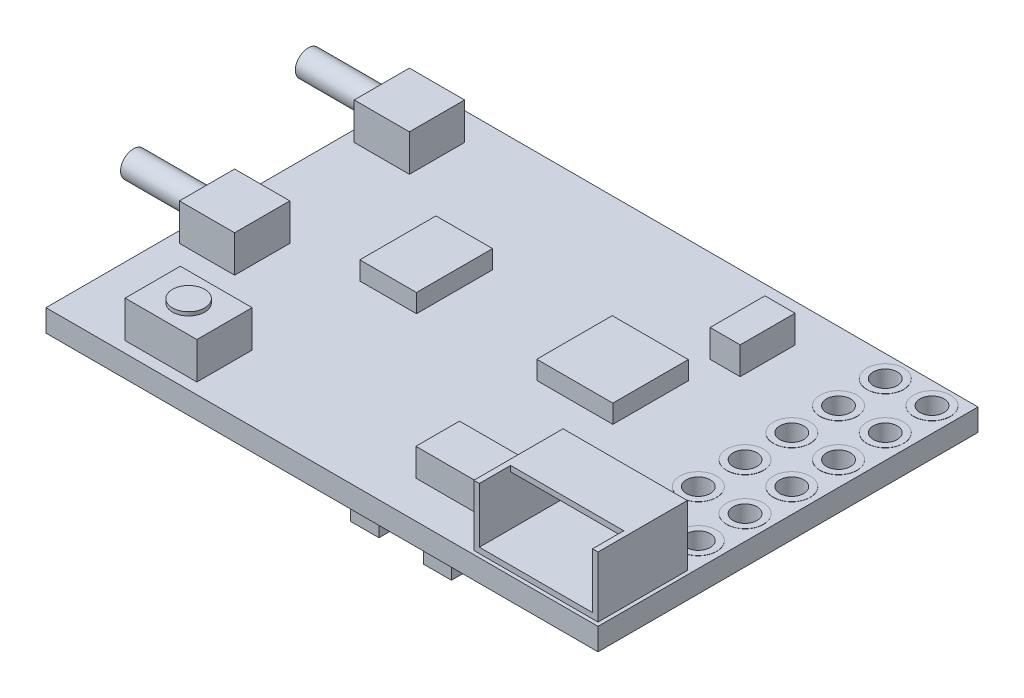
from build123d import *

# Parameters (mm, degrees)
SKETCH1_W            = 30
SKETCH1_H            = 20.65
BOSS_EXTRUDE1_DEPTH  = 1.2
CUT_EXTRUDE1_REACH   = 20.25
SKETCH2_R            = 0.65
SKETCH3_W            = 6.75
SKETCH3_H            = 4.85
BOSS_EXTRUDE2_DEPTH  = 3.3
SKETCH4_W            = 3
SKETCH4_H            = 3
BOSS_EXTRUDE3_DEPTH  = 2
SKETCH5_W            = 3.9
SKETCH5_H            = 3
BOSS_EXTRUDE4_DEPTH  = 2
SKETCH6_R            = 0.875
BOSS_EXTRUDE5_DEPTH  = 0.2
SKETCH7_W            = 6.15
SKETCH7_H            = 1.7
CUT_EXTRUDE2_DEPTH   = 3
SKETCH8_W            = 6.15
SKETCH8_H            = 2.7
CUT_EXTRUDE3_DEPTH   = 2.85
SKETCH9_W            = 4.13358082
SKETCH9_H            = 4.101537558
SKETCH9_W_2          = 3.076153169
SKETCH9_H_2          = 4.13358082
BOSS_EXTRUDE6_DEPTH  = 1
SKETCH10_W           = 1.634206371
SKETCH10_H           = 2.980023382
SKETCH10_W_2         = 4.454013442
SKETCH10_H_2         = 2.371201401
BOSS_EXTRUDE7_DEPTH  = 1.5
SKETCH11_W           = 6.849678862
SKETCH11_H           = 6.849678863
SKETCH11_W_2         = 1.518707079
SKETCH11_H_2         = 3.006420134
SKETCH11_W_3         = 1.5497011
SKETCH11_H_3         = 3.068408178
SKETCH11_W_4         = 1.177772837
SKETCH11_H_4         = 2.758467958
SKETCH11_W_5         = 2.86022906
SKETCH11_H_5         = 4.18419297
SKETCH11_W_6         = 2.386539694
SKETCH11_H_6         = 3.0994022
SKETCH11_W_7         = 1.270754903
SKETCH11_H_7         = 3.161390244
BOSS_EXTRUDE8_DEPTH  = 1.5
BOSS_EXTRUDE9_START  = 0.01
SKETCH12_R           = 1
SKETCH12_R_2         = 0.65
BOSS_EXTRUDE9_DEPTH  = 0.01
SKETCH13_R           = 0.7
BOSS_EXTRUDE10_DEPTH = 4


with BuildPart() as part:
    # Sketch1 → Boss-Extrude1 (new body)
    with BuildSketch(Plane(origin=(0, 0, 0), x_dir=(1, 0, 0), z_dir=(0, 1, 0))):
        Rectangle(SKETCH1_W, SKETCH1_H)
    extrude(amount=BOSS_EXTRUDE1_DEPTH)

    # Sketch2 → Cut-Extrude1 (cut, up to next)
    with BuildSketch(Plane(origin=(0, 1.2, 0), x_dir=(1, 0, 0), z_dir=(0, 1, 0)), mode=Mode.PRIVATE) as cut_extrude1_sk1:
        with Locations(Location((13.7, 9.125, 0), (0, 0, 270))):
            Circle(SKETCH2_R)
    cut_extrude1_tool1 = extrude(cut_extrude1_sk1.sketch, amount=-CUT_EXTRUDE1_REACH, mode=Mode.PRIVATE) & part.part
    # Sketch2 → Cut-Extrude1 (cut, up to next)
    with BuildSketch(Plane(origin=(0, 1.2, 0), x_dir=(1, 0, 0), z_dir=(0, 1, 0)), mode=Mode.PRIVATE) as cut_extrude1_sk2:
        with Locations(Location((11.16, 9.125, 0), (0, 0, 270))):
            Circle(SKETCH2_R)
    cut_extrude1_tool2 = extrude(cut_extrude1_sk2.sketch, amount=-CUT_EXTRUDE1_REACH, mode=Mode.PRIVATE) & part.part
    # Sketch2 → Cut-Extrude1 (cut, up to next)
    with BuildSketch(Plane(origin=(0, 1.2, 0), x_dir=(1, 0, 0), z_dir=(0, 1, 0)), mode=Mode.PRIVATE) as cut_extrude1_sk3:
        with Locations(Location((11.16, 6.585, 0), (0, 0, 270))):
            Circle(SKETCH2_R)
    cut_extrude1_tool3 = extrude(cut_extrude1_sk3.sketch, amount=-CUT_EXTRUDE1_REACH, mode=Mode.PRIVATE) & part.part
    # Sketch2 → Cut-Extrude1 (cut, up to next)
    with BuildSketch(Plane(origin=(0, 1.2, 0), x_dir=(1, 0, 0), z_dir=(0, 1, 0)), mode=Mode.PRIVATE) as cut_extrude1_sk4:
        with Locations(Location((11.16, 4.045, 0), (0, 0, 270))):
            Circle(SKETCH2_R)
    cut_extrude1_tool4 = extrude(cut_extrude1_sk4.sketch, amount=-CUT_EXTRUDE1_REACH, mode=Mode.PRIVATE) & part.part
    # Sketch2 → Cut-Extrude1 (cut, up to next)
    with BuildSketch(Plane(origin=(0, 1.2, 0), x_dir=(1, 0, 0), z_dir=(0, 1, 0)), mode=Mode.PRIVATE) as cut_extrude1_sk5:
        with Locations(Location((11.16, 1.505, 0), (0, 0, 270))):
            Circle(SKETCH2_R)
    cut_extrude1_tool5 = extrude(cut_extrude1_sk5.sketch, amount=-CUT_EXTRUDE1_REACH, mode=Mode.PRIVATE) & part.part
    # Sketch2 → Cut-Extrude1 (cut, up to next)
    with BuildSketch(Plane(origin=(0, 1.2, 0), x_dir=(1, 0, 0), z_dir=(0, 1, 0)), mode=Mode.PRIVATE) as cut_extrude1_sk6:
        with Locations(Location((11.16, -1.035, 0), (0, 0, 270))):
            Circle(SKETCH2_R)
    cut_extrude1_tool6 = extrude(cut_extrude1_sk6.sketch, amount=-CUT_EXTRUDE1_REACH, mode=Mode.PRIVATE) & part.part
    # Sketch2 → Cut-Extrude1 (cut, up to next)
    with BuildSketch(Plane(origin=(0, 1.2, 0), x_dir=(1, 0, 0), z_dir=(0, 1, 0)), mode=Mode.PRIVATE) as cut_extrude1_sk7:
        with Locations(Location((11.16, -3.575, 0), (0, 0, 270))):
            Circle(SKETCH2_R)
    cut_extrude1_tool7 = extrude(cut_extrude1_sk7.sketch, amount=-CUT_EXTRUDE1_REACH, mode=Mode.PRIVATE) & part.part
    # Sketch2 → Cut-Extrude1 (cut, up to next)
    with BuildSketch(Plane(origin=(0, 1.2, 0), x_dir=(1, 0, 0), z_dir=(0, 1, 0)), mode=Mode.PRIVATE) as cut_extrude1_sk8:
        with Locations(Location((13.7, 6.585, 0), (0, 0, 270))):
            Circle(SKETCH2_R)
    cut_extrude1_tool8 = extrude(cut_extrude1_sk8.sketch, amount=-CUT_EXTRUDE1_REACH, mode=Mode.PRIVATE) & part.part
    # Sketch2 → Cut-Extrude1 (cut, up to next)
    with BuildSketch(Plane(origin=(0, 1.2, 0), x_dir=(1, 0, 0), z_dir=(0, 1, 0)), mode=Mode.PRIVATE) as cut_extrude1_sk9:
        with Locations(Location((13.7, 4.045, 0), (0, 0, 270))):
            Circle(SKETCH2_R)
    cut_extrude1_tool9 = extrude(cut_extrude1_sk9.sketch, amount=-CUT_EXTRUDE1_REACH, mode=Mode.PRIVATE) & part.part
    # Sketch2 → Cut-Extrude1 (cut, up to next)
    with BuildSketch(Plane(origin=(0, 1.2, 0), x_dir=(1, 0, 0), z_dir=(0, 1, 0)), mode=Mode.PRIVATE) as cut_extrude1_sk10:
        with Locations(Location((13.7, 1.505, 0), (0, 0, 270))):
            Circle(SKETCH2_R)
    cut_extrude1_tool10 = extrude(cut_extrude1_sk10.sketch, amount=-CUT_EXTRUDE1_REACH, mode=Mode.PRIVATE) & part.part
    # Sketch2 → Cut-Extrude1 (cut, up to next)
    with BuildSketch(Plane(origin=(0, 1.2, 0), x_dir=(1, 0, 0), z_dir=(0, 1, 0)), mode=Mode.PRIVATE) as cut_extrude1_sk11:
        with Locations(Location((13.7, -1.035, 0), (0, 0, 270))):
            Circle(SKETCH2_R)
    cut_extrude1_tool11 = extrude(cut_extrude1_sk11.sketch, amount=-CUT_EXTRUDE1_REACH, mode=Mode.PRIVATE) & part.part
    # Sketch2 → Cut-Extrude1 (cut, up to next)
    with BuildSketch(Plane(origin=(0, 1.2, 0), x_dir=(1, 0, 0), z_dir=(0, 1, 0)), mode=Mode.PRIVATE) as cut_extrude1_sk12:
        with Locations(Location((13.7, -3.575, 0), (0, 0, 270))):
            Circle(SKETCH2_R)
    cut_extrude1_tool12 = extrude(cut_extrude1_sk12.sketch, amount=-CUT_EXTRUDE1_REACH, mode=Mode.PRIVATE) & part.part
    add(cut_extrude1_tool1.solids().sort_by_distance((13.7, 1.2, -9.125))[0], mode=Mode.SUBTRACT)
    add(cut_extrude1_tool2.solids().sort_by_distance((11.16, 1.2, -9.125))[0], mode=Mode.SUBTRACT)
    add(cut_extrude1_tool3.solids().sort_by_distance((11.16, 1.2, -6.585))[0], mode=Mode.SUBTRACT)
    add(cut_extrude1_tool4.solids().sort_by_distance((11.16, 1.2, -4.045))[0], mode=Mode.SUBTRACT)
    add(cut_extrude1_tool5.solids().sort_by_distance((11.16, 1.2, -1.505))[0], mode=Mode.SUBTRACT)
    add(cut_extrude1_tool6.solids().sort_by_distance((11.16, 1.2, 1.035))[0], mode=Mode.SUBTRACT)
    add(cut_extrude1_tool7.solids().sort_by_distance((11.16, 1.2, 3.575))[0], mode=Mode.SUBTRACT)
    add(cut_extrude1_tool8.solids().sort_by_distance((13.7, 1.2, -6.585))[0], mode=Mode.SUBTRACT)
    add(cut_extrude1_tool9.solids().sort_by_distance((13.7, 1.2, -4.045))[0], mode=Mode.SUBTRACT)
    add(cut_extrude1_tool10.solids().sort_by_distance((13.7, 1.2, -1.505))[0], mode=Mode.SUBTRACT)
    add(cut_extrude1_tool11.solids().sort_by_distance((13.7, 1.2, 1.035))[0], mode=Mode.SUBTRACT)
    add(cut_extrude1_tool12.solids().sort_by_distance((13.7, 1.2, 3.575))[0], mode=Mode.SUBTRACT)

    # Sketch3 → Boss-Extrude2 (add)
    with BuildSketch(Plane(origin=(0, 1.2, 0), x_dir=(1, 0, 0), z_dir=(0, 1, 0))):
        with Locations((11.425, -7.7)):
            Rectangle(SKETCH3_W, SKETCH3_H)
    extrude(amount=BOSS_EXTRUDE2_DEPTH)

    # Sketch4 → Boss-Extrude3 (add)
    with BuildSketch(Plane(origin=(0, 1.2, 0), x_dir=(1, 0, 0), z_dir=(0, 1, 0))):
        with Locations((-12.9, 7.325)):
            Rectangle(SKETCH4_W, SKETCH4_H)
        with Locations((-12.9, -2.175)):
            Rectangle(SKETCH4_W, SKETCH4_H)
    extrude(amount=BOSS_EXTRUDE3_DEPTH)

    # Sketch5 → Boss-Extrude4 (add)
    with BuildSketch(Plane(origin=(0, 1.2, 0), x_dir=(1, 0, 0), z_dir=(0, 1, 0))):
        with Locations((-9.35, -8.225)):
            Rectangle(SKETCH5_W, SKETCH5_H)
    extrude(amount=BOSS_EXTRUDE4_DEPTH)

    # Sketch6 → Boss-Extrude5 (add)
    with BuildSketch(Plane(origin=(0, 3.2, 0), x_dir=(1, 0, 0), z_dir=(0, 1, 0))):
        with Locations(Location((-9.35, -8.225, 0), (0, 0, 90))):
            Circle(SKETCH6_R)
    extrude(amount=BOSS_EXTRUDE5_DEPTH)

    # Sketch7 → Cut-Extrude2 (cut)
    with BuildSketch(Plane(origin=(0, 4.5, 0), x_dir=(1, 0, 0), z_dir=(0, 1, 0))):
        with Locations((11.425, -9.275)):
            Rectangle(SKETCH7_W, SKETCH7_H)
    extrude(amount=-CUT_EXTRUDE2_DEPTH, mode=Mode.SUBTRACT)

    # Sketch8 → Cut-Extrude3 (cut)
    with BuildSketch(Plane.XY.offset(8.425)):
        with Locations((11.425, 2.85)):
            Rectangle(SKETCH8_W, SKETCH8_H)
    extrude(amount=-CUT_EXTRUDE3_DEPTH, mode=Mode.SUBTRACT)

    # Sketch9 → Boss-Extrude6 (add)
    with BuildSketch(Plane(origin=(0, 1.2, 0), x_dir=(1, 0, 0), z_dir=(0, 1, 0))):
        with Locations((3.82916983, 1.634206371)):
            Rectangle(SKETCH9_W, SKETCH9_H)
        with Locations((-6.1843496, 1.522054953)):
            Rectangle(SKETCH9_W_2, SKETCH9_H_2)
    extrude(amount=BOSS_EXTRUDE6_DEPTH)

    # Sketch10 → Boss-Extrude7 (add)
    with BuildSketch(Plane(origin=(0, 1.2, 0), x_dir=(1, 0, 0), z_dir=(0, 1, 0))):
        with Locations((6.296501018, 6.77714995)):
            Rectangle(SKETCH10_W, SKETCH10_H)
        with Locations((5.30315989, -7.113604202)):
            Rectangle(SKETCH10_W_2, SKETCH10_H_2)
    extrude(amount=BOSS_EXTRUDE7_DEPTH)

    # Sketch11 → Boss-Extrude8 (add)
    with BuildSketch(Plane.XZ):
        with Locations((-2.928935079, -0.803882292)):
            Rectangle(SKETCH11_W, SKETCH11_H)
        with Locations((5.387348503, 7.936431913)):
            Rectangle(SKETCH11_W_2, SKETCH11_H_2)
        with Locations((1.404616675, 7.874443869)):
            Rectangle(SKETCH11_W_3, SKETCH11_H_3)
        with Locations((5.557815623, 4.248143295)):
            Rectangle(SKETCH11_W_4, SKETCH11_H_4)
        with Locations((-13.56988547, -6.475788318)):
            Rectangle(SKETCH11_W_5, SKETCH11_H_5)
        with Locations((-12.403220127, 2.249028876)):
            Rectangle(SKETCH11_W_6, SKETCH11_H_6)
        with Locations((-9.365805971, -7.886016319)):
            Rectangle(SKETCH11_W_7, SKETCH11_H_7)
    extrude(amount=BOSS_EXTRUDE8_DEPTH)

    # Sketch12 → Boss-Extrude9 (add)
    # profile 1 of 12: a face of its own
    with BuildSketch(Plane(origin=(0, 1.2, 0), x_dir=(1, 0, 0), z_dir=(0, 1, 0)).offset(BOSS_EXTRUDE9_START)):
        with Locations(Location((11.16, 9.125, 0), (0, 0, 90))):
            Circle(SKETCH12_R)
        with Locations(Location((11.16, 9.125, 0), (0, 0, 270))):
            Circle(SKETCH12_R_2, mode=Mode.SUBTRACT)
    # profile 2 of 12: a face of its own
    with BuildSketch(Plane(origin=(0, 1.2, 0), x_dir=(1, 0, 0), z_dir=(0, 1, 0)).offset(BOSS_EXTRUDE9_START)):
        with Locations(Location((13.7, 9.125, 0), (0, 0, 90))):
            Circle(SKETCH12_R)
        with Locations(Location((13.7, 9.125, 0), (0, 0, 270))):
            Circle(SKETCH12_R_2, mode=Mode.SUBTRACT)
    # profile 3 of 12: a face of its own
    with BuildSketch(Plane(origin=(0, 1.2, 0), x_dir=(1, 0, 0), z_dir=(0, 1, 0)).offset(BOSS_EXTRUDE9_START)):
        with Locations(Location((13.7, 6.585, 0), (0, 0, 90))):
            Circle(SKETCH12_R)
        with Locations(Location((13.7, 6.585, 0), (0, 0, 270))):
            Circle(SKETCH12_R_2, mode=Mode.SUBTRACT)
    # profile 4 of 12: a face of its own
    with BuildSketch(Plane(origin=(0, 1.2, 0), x_dir=(1, 0, 0), z_dir=(0, 1, 0)).offset(BOSS_EXTRUDE9_START)):
        with Locations(Location((11.16, 6.585, 0), (0, 0, 90))):
            Circle(SKETCH12_R)
        with Locations(Location((11.16, 6.585, 0), (0, 0, 270))):
            Circle(SKETCH12_R_2, mode=Mode.SUBTRACT)
    # profile 5 of 12: a face of its own
    with BuildSketch(Plane(origin=(0, 1.2, 0), x_dir=(1, 0, 0), z_dir=(0, 1, 0)).offset(BOSS_EXTRUDE9_START)):
        with Locations(Location((11.16, 4.045, 0), (0, 0, 90))):
            Circle(SKETCH12_R)
        with Locations(Location((11.16, 4.045, 0), (0, 0, 270))):
            Circle(SKETCH12_R_2, mode=Mode.SUBTRACT)
    # profile 6 of 12: a face of its own
    with BuildSketch(Plane(origin=(0, 1.2, 0), x_dir=(1, 0, 0), z_dir=(0, 1, 0)).offset(BOSS_EXTRUDE9_START)):
        with Locations(Location((13.7, 4.045, 0), (0, 0, 90))):
            Circle(SKETCH12_R)
        with Locations(Location((13.7, 4.045, 0), (0, 0, 270))):
            Circle(SKETCH12_R_2, mode=Mode.SUBTRACT)
    # profile 7 of 12: a face of its own
    with BuildSketch(Plane(origin=(0, 1.2, 0), x_dir=(1, 0, 0), z_dir=(0, 1, 0)).offset(BOSS_EXTRUDE9_START)):
        with Locations(Location((13.7, 1.505, 0), (0, 0, 90))):
            Circle(SKETCH12_R)
        with Locations(Location((13.7, 1.505, 0), (0, 0, 270))):
            Circle(SKETCH12_R_2, mode=Mode.SUBTRACT)
    # profile 8 of 12: a face of its own
    with BuildSketch(Plane(origin=(0, 1.2, 0), x_dir=(1, 0, 0), z_dir=(0, 1, 0)).offset(BOSS_EXTRUDE9_START)):
        with Locations(Location((11.16, 1.505, 0), (0, 0, 90))):
            Circle(SKETCH12_R)
        with Locations(Location((11.16, 1.505, 0), (0, 0, 270))):
            Circle(SKETCH12_R_2, mode=Mode.SUBTRACT)
    # profile 9 of 12: a face of its own
    with BuildSketch(Plane(origin=(0, 1.2, 0), x_dir=(1, 0, 0), z_dir=(0, 1, 0)).offset(BOSS_EXTRUDE9_START)):
        with Locations(Location((11.16, -1.035, 0), (0, 0, 90))):
            Circle(SKETCH12_R)
        with Locations(Location((11.16, -1.035, 0), (0, 0, 270))):
            Circle(SKETCH12_R_2, mode=Mode.SUBTRACT)
    # profile 10 of 12: a face of its own
    with BuildSketch(Plane(origin=(0, 1.2, 0), x_dir=(1, 0, 0), z_dir=(0, 1, 0)).offset(BOSS_EXTRUDE9_START)):
        with Locations(Location((11.16, -3.575, 0), (0, 0, 90))):
            Circle(SKETCH12_R)
        with Locations(Location((11.16, -3.575, 0), (0, 0, 270))):
            Circle(SKETCH12_R_2, mode=Mode.SUBTRACT)
    # profile 11 of 12: a face of its own
    with BuildSketch(Plane(origin=(0, 1.2, 0), x_dir=(1, 0, 0), z_dir=(0, 1, 0)).offset(BOSS_EXTRUDE9_START)):
        with Locations(Location((13.7, -3.575, 0), (0, 0, 90))):
            Circle(SKETCH12_R)
        with Locations(Location((13.7, -3.575, 0), (0, 0, 270))):
            Circle(SKETCH12_R_2, mode=Mode.SUBTRACT)
    # profile 12 of 12: a face of its own
    with BuildSketch(Plane(origin=(0, 1.2, 0), x_dir=(1, 0, 0), z_dir=(0, 1, 0)).offset(BOSS_EXTRUDE9_START)):
        with Locations(Location((13.7, -1.035, 0), (0, 0, 90))):
            Circle(SKETCH12_R)
        with Locations(Location((13.7, -1.035, 0), (0, 0, 270))):
            Circle(SKETCH12_R_2, mode=Mode.SUBTRACT)
    boss_extrude9 = extrude(amount=-BOSS_EXTRUDE9_DEPTH)

    # Mirror1: Boss-Extrude9 across plane
    add(boss_extrude9.mirror(Plane.ZX.offset(0.6)))

    # Sketch13 → Boss-Extrude10 (add)
    with BuildSketch(Plane.ZY.offset(14.4)):
        with Locations(Location((-7.325, 2.2, 0), (0, 0, 180))):
            Circle(SKETCH13_R)
        with Locations(Location((2.175, 2.2, 0), (0, 0, 180))):
            Circle(SKETCH13_R)
    extrude(amount=BOSS_EXTRUDE10_DEPTH)


solid = part.part
